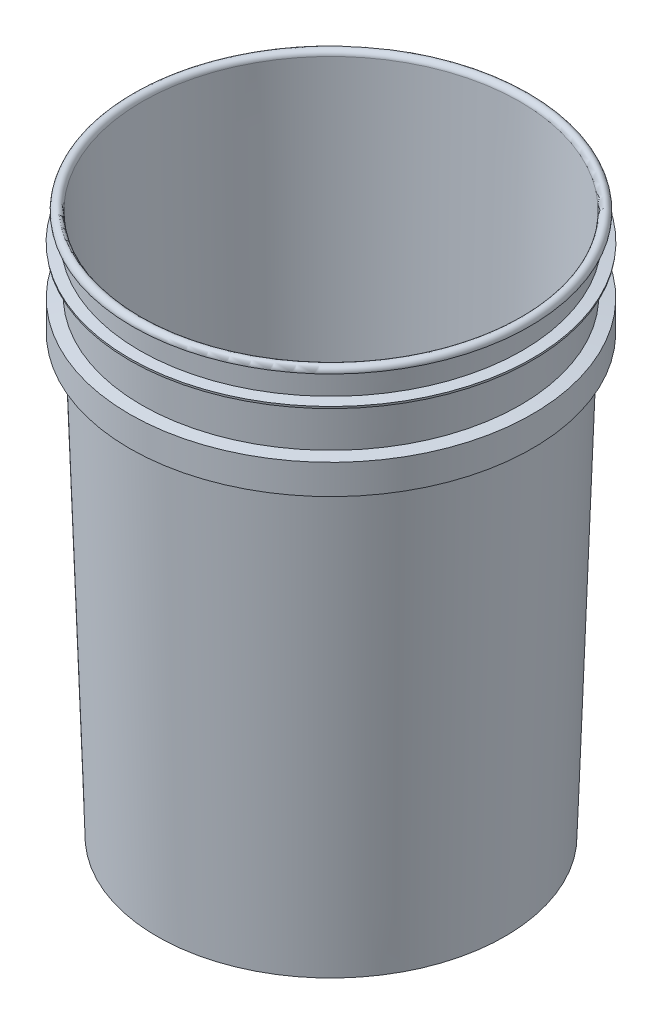
from build123d import *

# Parameters (mm, degrees)
SCALE1_SCALE = 24.694444444


with BuildPart() as part:
    # Sketch1 → Revolve1 (revolve)
    with BuildSketch(Plane.XY, mode=Mode.PRIVATE) as revolve1_sk:
        with BuildLine():
            Line((0, -0.094227964), (-1.061247893, -0.094227964))
            Line((-1.061247893, -0.094227964), (-1.061247893, -0.200590652))
            Line((-1.061247893, -0.200590652), (-1.13806539, -0.200590652))
            Line((-1.13806539, -0.200590652), (-1.13806539, -0.094227964))
            Line((-1.13806539, -0.094227964), (-5.395815038, -0.08834647))
            Line((-5.395815038, -0.08834647), (-5.395815038, -0.200590652))
            Line((-5.395815038, -0.200590652), (-5.482893557, -0.200590652))
            Line((-5.482893557, -0.200590652), (-5.966284415, 14.474501006))
            Line((-5.966284415, 14.474501006), (-6.27388996, 14.425226712))
            Line((-6.27388996, 14.425226712), (-6.27388996, 13.549490193))
            Line((-6.27388996, 13.549490193), (-6.346091135, 13.549490193))
            Line((-6.346091135, 13.549490193), (-6.346091135, 14.485650511))
            Line((-6.346091135, 14.485650511), (-5.968643269, 14.546112611))
            Line((-5.968643269, 14.546112611), (-6.016345654, 15.994292405))
            Line((-6.016345654, 15.994292405), (-6.340619476, 15.947459591))
            Line((-6.340619476, 15.947459591), (-6.350120653, 16.013246438))
            Line((-6.350120653, 16.013246438), (-6.025480097, 16.060132217))
            Line((-6.025480097, 16.060132217), (-6.048293639, 16.861870002))
            ThreePointArc((-6.048293639, 16.861870002), (-6.138820306, 16.886263059), (-6.215951685, 16.832963442))
            Line((-6.215951685, 16.832963442), (-6.256868902, 16.832963442))
            ThreePointArc((-6.256868902, 16.832963442), (-6.123324966, 17.009958484), (-5.954407696, 16.866333335))
            Line((-5.954407696, 16.866333335), (-5.39906689, 0.006938679))
            Line((-5.39906689, 0.006938679), (0, 0))
            Line((0, 0), (0, -0.094227964))
        make_face()
    revolve(revolve1_sk.sketch.rotate(Axis((0, 0, 0), (0, 1, 0)), 270), axis=Axis((0, 0, 0), (0, 1, 0)))


with BuildPart() as part_1:
    # Scale1: scaled about (0, 7.960069981, 0)
    add(part.part.scale(SCALE1_SCALE).moved(Location((0, -188.609435939, 0))))


solid = part_1.part
